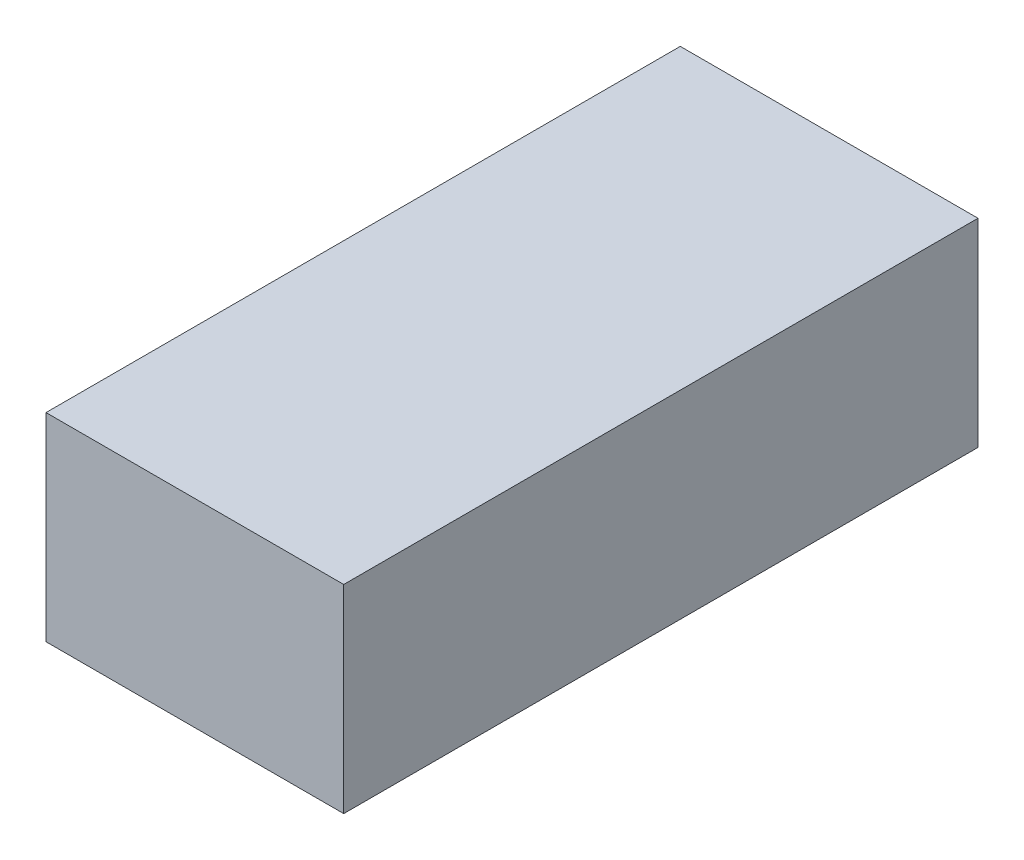
from build123d import *

# Parameters (mm, degrees)
SKETCH1_W           = 34.500058
SKETCH1_H           = 23.0000048
BOSS_EXTRUDE1_DEPTH = 36.74999


with BuildPart() as part:
    # Sketch1 → Boss-Extrude1 (new, symmetric)
    with BuildSketch(Plane.XY):
        Rectangle(SKETCH1_W, SKETCH1_H)
    extrude(amount=BOSS_EXTRUDE1_DEPTH, both=True)


solid = part.part
